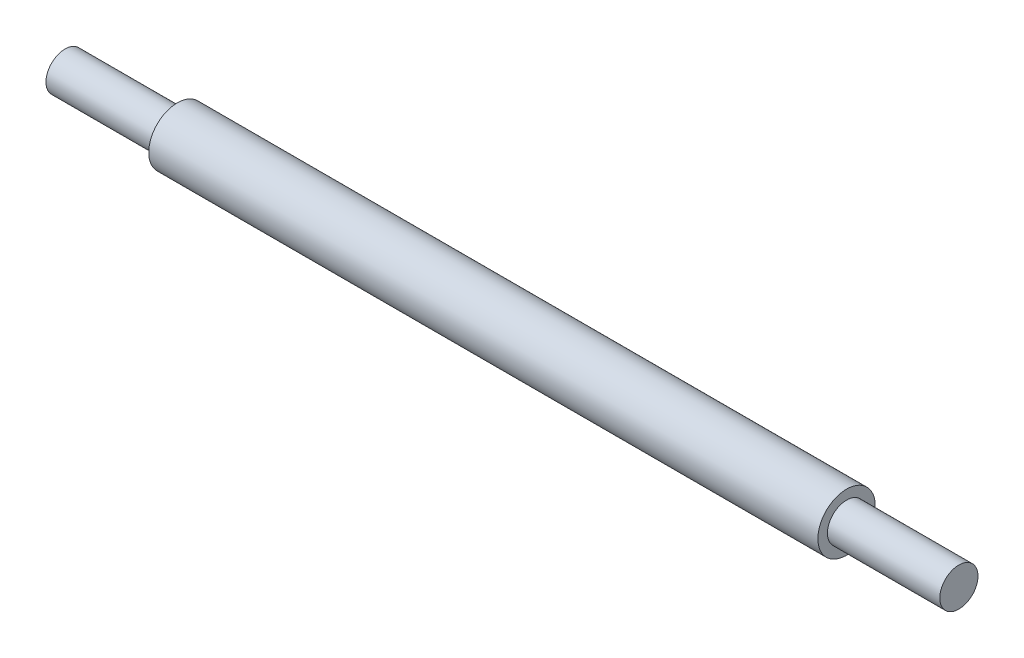
from build123d import *

# Parameters (mm, degrees)
BOSS_EXTRUDE1_DEPTH      = 35
BOSS_EXTRUDE1_DEPTH_BACK = 35
SKETCH1_R                = 3
BOSS_EXTRUDE2_DEPTH      = 46.75
BOSS_EXTRUDE2_DEPTH_BACK = 46.75
SKETCH3_R                = 2


with BuildPart() as part:
    # Sketch1 → Boss-Extrude1 (new, two sides: drawn at the far end of the back side and taken through both)
    with BuildSketch(Plane(origin=(0, 0, 0), x_dir=(0, 0, -1), z_dir=(1, 0, 0)).offset(-BOSS_EXTRUDE1_DEPTH_BACK)):
        Circle(SKETCH1_R)
    extrude(amount=BOSS_EXTRUDE1_DEPTH + BOSS_EXTRUDE1_DEPTH_BACK)

    # Sketch3 → Boss-Extrude2 (add, two sides: drawn at the far end of the back side and taken through both)
    with BuildSketch(Plane(origin=(0, 0, 0), x_dir=(0, 0, -1), z_dir=(1, 0, 0)).offset(-BOSS_EXTRUDE2_DEPTH_BACK)):
        Circle(SKETCH3_R)
    extrude(amount=BOSS_EXTRUDE2_DEPTH + BOSS_EXTRUDE2_DEPTH_BACK)


solid = part.part
